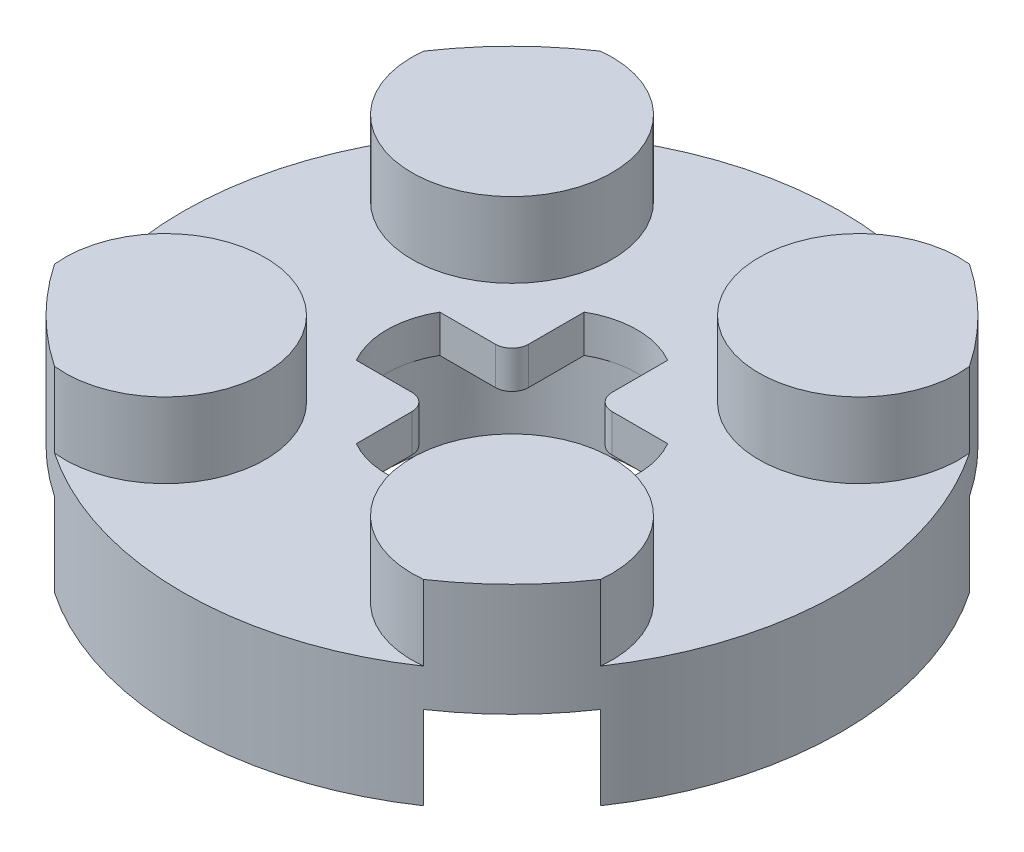
from build123d import *
from build123d.topology import SkipClean

# Parameters (mm, degrees)
SKETCH1_R               = 7.9
BOSS_EXTRUDE1_DEPTH     = 0.9
CUT_EXTRUDE1_DEPTH      = 12.208478933
CUT_EXTRUDE1_DEPTH_BACK = 12.208478933
BOSS_EXTRUDE2_DEPTH     = 1.8
CIRPATTERN1_COUNT       = 4
SKETCH4_R               = 3.6
SKETCH4_R_2             = 3
BOSS_EXTRUDE5_DEPTH     = 2
BOSS_EXTRUDE6_START     = 2
BOSS_EXTRUDE6_DEPTH     = 2
CIRPATTERN2_COUNT       = 4
SKETCH7_R               = 1.3
CUT_EXTRUDE2_DEPTH      = 1.7
CIRPATTERN3_COUNT       = 4


with BuildPart() as part:
    # Sketch1 → Boss-Extrude1 (new body)
    with BuildSketch(Plane(origin=(0, 0, 0), x_dir=(1, 0, 0), z_dir=(0, 1, 0))):
        Circle(SKETCH1_R)
    extrude(amount=BOSS_EXTRUDE1_DEPTH)

    # Sketch2 → Cut-Extrude1 (cut, two sides: drawn at the far end of the back side and taken through both)
    with BuildSketch(Plane(origin=(0, 0.9, 0), x_dir=(1, 0, 0), z_dir=(0, 1, 0)).offset(-CUT_EXTRUDE1_DEPTH_BACK)):
        with BuildLine():
            Line((-1.4, -1), (-2.732050808, -1))
            ThreePointArc((-2.732050808, -1), (-3, 0), (-2.732050808, 1))
            Line((-2.732050808, 1), (-1.4, 1))
            ThreePointArc((-1.4, 1), (-1.117157288, 1.117157288), (-1, 1.4))
            Line((-1, 1.4), (-1, 2.732050808))
            ThreePointArc((-1, 2.732050808), (0, 3), (1, 2.732050808))
            Line((1, 2.732050808), (1, 1.4))
            ThreePointArc((1, 1.4), (1.117157288, 1.117157288), (1.4, 1))
            Line((1.4, 1), (2.732050808, 1))
            ThreePointArc((2.732050808, 1), (3, 0), (2.732050808, -1))
            Line((2.732050808, -1), (1.4, -1))
            ThreePointArc((1.4, -1), (1.117157288, -1.117157288), (1, -1.4))
            Line((1, -1.4), (1, -2.732050808))
            ThreePointArc((1, -2.732050808), (0, -3), (-1, -2.732050808))
            Line((-1, -2.732050808), (-1, -1.4))
            ThreePointArc((-1, -1.4), (-1.117157288, -1.117157288), (-1.4, -1))
        make_face()
    extrude(amount=CUT_EXTRUDE1_DEPTH + CUT_EXTRUDE1_DEPTH_BACK, mode=Mode.SUBTRACT)

    # Sketch3 → Boss-Extrude2 (add)
    with BuildSketch(Plane(origin=(0, 0.9, 0), x_dir=(1, 0, 0), z_dir=(0, 1, 0))):
        with BuildLine():
            ThreePointArc((4.423863509, 6.545183852), (2.462703276, 2.462703276), (6.545183852, 4.423863509))
            ThreePointArc((6.545183852, 4.423863509), (5.586143571, 5.586143571), (4.423863509, 6.545183852))
        make_face()
    boss_extrude2 = extrude(amount=BOSS_EXTRUDE2_DEPTH)

    # CirPattern1: Boss-Extrude2 ×4 about axis
    cirpattern1_axis = Axis((0, 0.9, 0), (0, 1, 0))
    for i in range(1, CIRPATTERN1_COUNT):
        add(boss_extrude2.rotate(cirpattern1_axis, i * 360 / CIRPATTERN1_COUNT))

    # Sketch4 → Boss-Extrude5 (add)
    with BuildSketch(Plane.XZ):
        Circle(SKETCH4_R)
        Circle(SKETCH4_R_2, mode=Mode.SUBTRACT)
    extrude(amount=BOSS_EXTRUDE5_DEPTH)

    # Sketch6 → Boss-Extrude6 (add)
    with SkipClean():  # the faces are left unmerged after this step: merging them gives an invalid solid
        with BuildSketch(Plane.XZ.offset(BOSS_EXTRUDE6_START)):
            with BuildLine():
                Line((-6.545183852, -4.423863509), (-6.545183852, 4.423863509))
                ThreePointArc((-6.545183852, 4.423863509), (-7.9, 0), (-6.545183852, -4.423863509))
            make_face()
        boss_extrude6 = extrude(amount=-BOSS_EXTRUDE6_DEPTH)

    # CirPattern2: Boss-Extrude6 ×4 about axis
    with SkipClean():  # the faces are left unmerged after this step: merging them gives an invalid solid
        cirpattern2_axis = Axis((0, 0, 0), (0, 1, 0))
        for i in range(1, CIRPATTERN2_COUNT):
            add(boss_extrude6.rotate(cirpattern2_axis, i * 360 / CIRPATTERN2_COUNT))

    # Sketch7 → Cut-Extrude2 (cut)
    with SkipClean():  # the faces are left unmerged after this step: merging them gives an invalid solid
        with BuildSketch(Plane.XZ):
            with Locations((-4.423863509, -4.423863509)):
                Circle(SKETCH7_R)
        cut_extrude2 = extrude(amount=-CUT_EXTRUDE2_DEPTH, mode=Mode.SUBTRACT)

    # CirPattern3: Cut-Extrude2 ×4 about axis
    with SkipClean():  # the faces are left unmerged after this step: merging them gives an invalid solid
        cirpattern3_axis = Axis((0, 0, 0), (0, 1, 0))
        for i in range(1, CIRPATTERN3_COUNT):
            add(cut_extrude2.rotate(cirpattern3_axis, i * 360 / CIRPATTERN3_COUNT), mode=Mode.SUBTRACT)


solid = part.part
